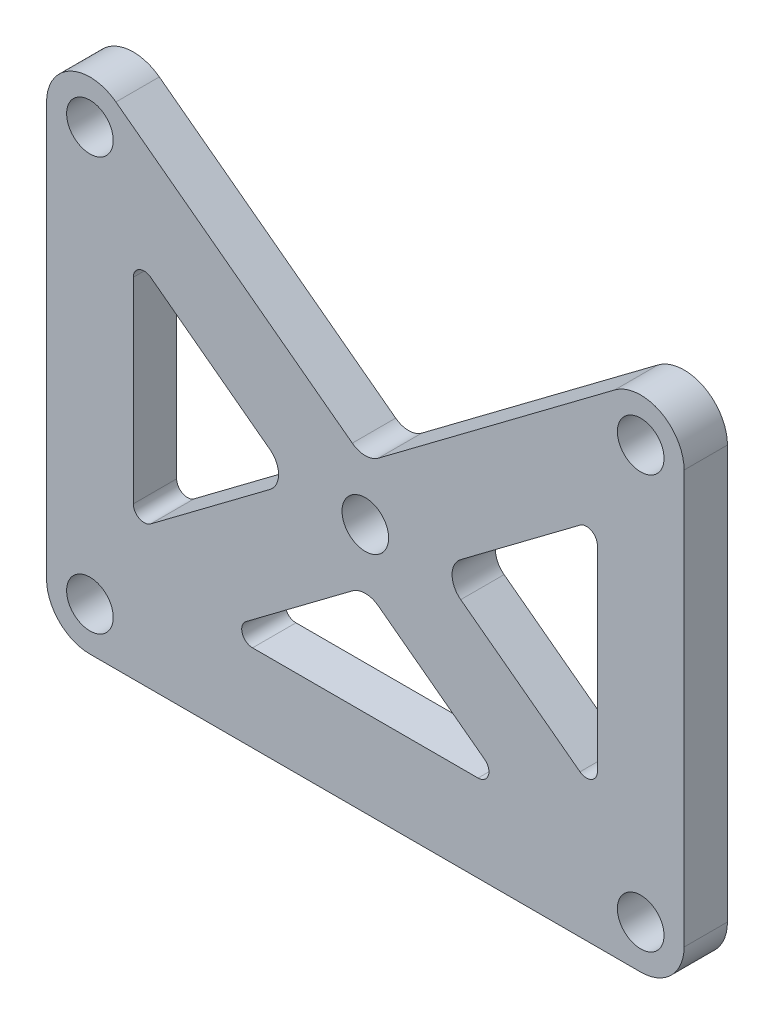
from build123d import *

# Parameters (mm, degrees)
SKETCH1_R           = 2.15
BOSS_EXTRUDE1_DEPTH = 4
FILLET1_R           = 2
FILLET3_R           = 1


with BuildPart() as part:
    # Sketch1 → Boss-Extrude1 (new body)
    with BuildSketch(Plane.XY):
        with BuildLine():
            Line((-5e-09, -4), (50.8, -4))
            ThreePointArc((50.8, -4), (53.628427143, -2.828427107), (54.8, 5.1e-08))
            Line((54.8, 5.1e-08), (54.8, 38.1))
            ThreePointArc((54.8, 38.1), (52.588854382, 41.677708764), (48.4, 41.3))
            Line((48.4, 41.3), (25.4, 24.05))
            Line((25.4, 24.05), (2.4, 41.3))
            ThreePointArc((2.4, 41.3), (-1.788854382, 41.677708764), (-4, 38.1))
            Line((-4, 38.1), (-4, 0))
            ThreePointArc((-4, 0), (-2.828427127, -2.828427123), (-5e-09, -4))
        make_face()
        Polygon((46.8, 8), (32.066666667, 19.05), (46.8, 30.1), align=None, mode=Mode.SUBTRACT)
        Circle(SKETCH1_R, mode=Mode.SUBTRACT)
        Polygon((4, 8), (4, 30.1), (18.733333333, 19.05), align=None, mode=Mode.SUBTRACT)
        Polygon((25.4, 14.05), (38.8, 4), (12, 4), align=None, mode=Mode.SUBTRACT)
        with Locations((25.4, 19.05)):
            Circle(SKETCH1_R, mode=Mode.SUBTRACT)
        with Locations((50.8, 0)):
            Circle(SKETCH1_R, mode=Mode.SUBTRACT)
        with Locations((0, 38.1)):
            Circle(SKETCH1_R, mode=Mode.SUBTRACT)
        with Locations((50.8, 38.1)):
            Circle(SKETCH1_R, mode=Mode.SUBTRACT)
    extrude(amount=BOSS_EXTRUDE1_DEPTH)

    # Fillet1
    fillet1_edges = [part.edges().sort_by_distance(p)[0] for p in [
        (18.733333333, 19.05, 2),
        (25.4, 14.05, 2),
        (32.066666667, 19.05, 2),
        (25.4, 24.05, 2),
    ]]
    fillet(fillet1_edges, radius=FILLET1_R)

    # Fillet3
    fillet3_edges = [part.edges().sort_by_distance(p)[0] for p in [
        (4, 30.1, 2),
        (4, 8, 2),
        (12, 4, 2),
        (38.8, 4, 2),
        (46.8, 30.1, 2),
        (46.8, 8, 2),
    ]]
    fillet(fillet3_edges, radius=FILLET3_R)


solid = part.part
